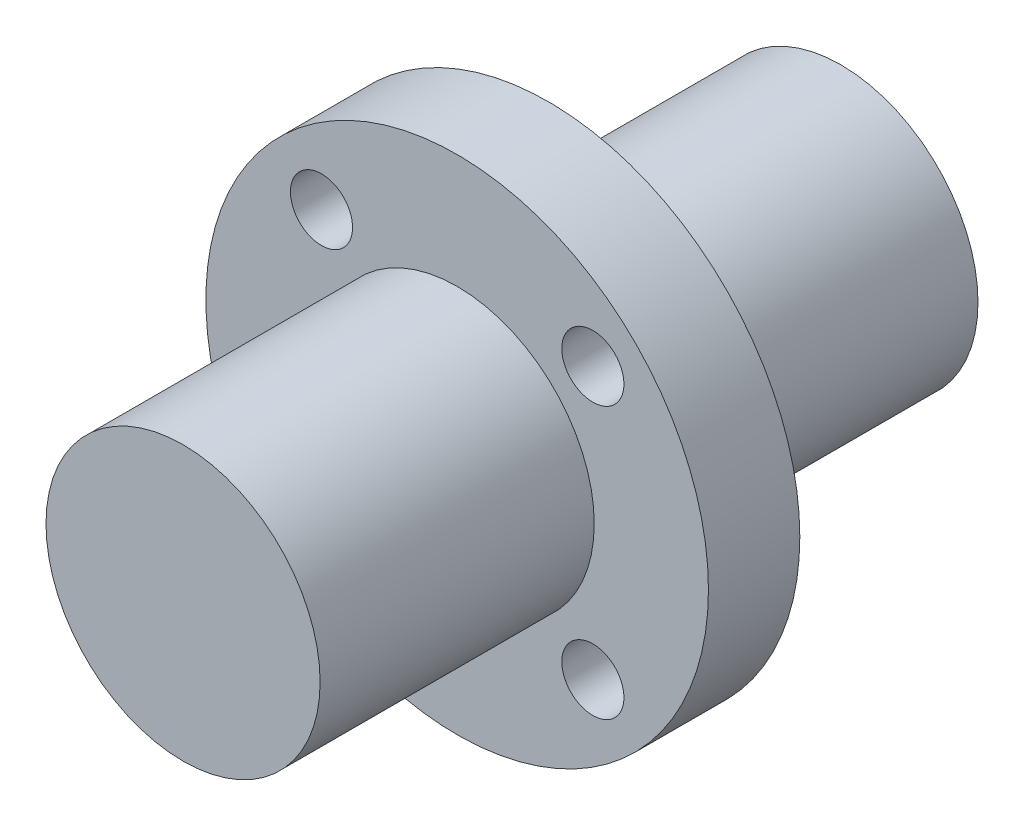
from build123d import *

# Parameters (mm, degrees)
SKETCH_1_R           = 27.5
SKETCH_1_R_2         = 3
EXTRUDE_1_DEPTH      = 10
HOLE_WIZARD_M8_1_D   = 6.8
EXTRUDE_2_DEPTH      = 32
EXTRUDE_2_DEPTH_BACK = 40
SKETCH_6_R           = 15


with BuildPart() as part:
    # 草图1 → 凸台-拉伸1 (new body)
    with BuildSketch(Plane.XY):
        Circle(SKETCH_1_R)
        with Locations((-14.849242405, -14.849242405)):
            Circle(SKETCH_1_R_2, mode=Mode.SUBTRACT)
        with Locations((14.849242405, -14.849242405)):
            Circle(SKETCH_1_R_2, mode=Mode.SUBTRACT)
        with Locations((14.849242405, 14.849242405)):
            Circle(SKETCH_1_R_2, mode=Mode.SUBTRACT)
        with Locations((-14.849242405, 14.849242405)):
            Circle(SKETCH_1_R_2, mode=Mode.SUBTRACT)
    extrude(amount=EXTRUDE_1_DEPTH)

    # M8 螺纹孔1 (through all)
    with Locations(Plane(origin=(0, 0, 0), x_dir=(1, 0, 0), z_dir=(0, 0, -1))):
        with Locations((-14.849242405, -14.849242405), (14.849242405, -14.849242405), (14.849242405, 14.849242405), (-14.849242405, 14.849242405)):
            Hole(HOLE_WIZARD_M8_1_D / 2)

    # 草图6 → 凸台-拉伸2 (add, two sides: drawn at the far end of the back side and taken through both)
    with BuildSketch(Plane(origin=(0, 0, 0), x_dir=(-1, 0, 0), z_dir=(0, 0, -1)).offset(-EXTRUDE_2_DEPTH_BACK)):
        Circle(SKETCH_6_R)
    extrude(amount=EXTRUDE_2_DEPTH + EXTRUDE_2_DEPTH_BACK)


solid = part.part
